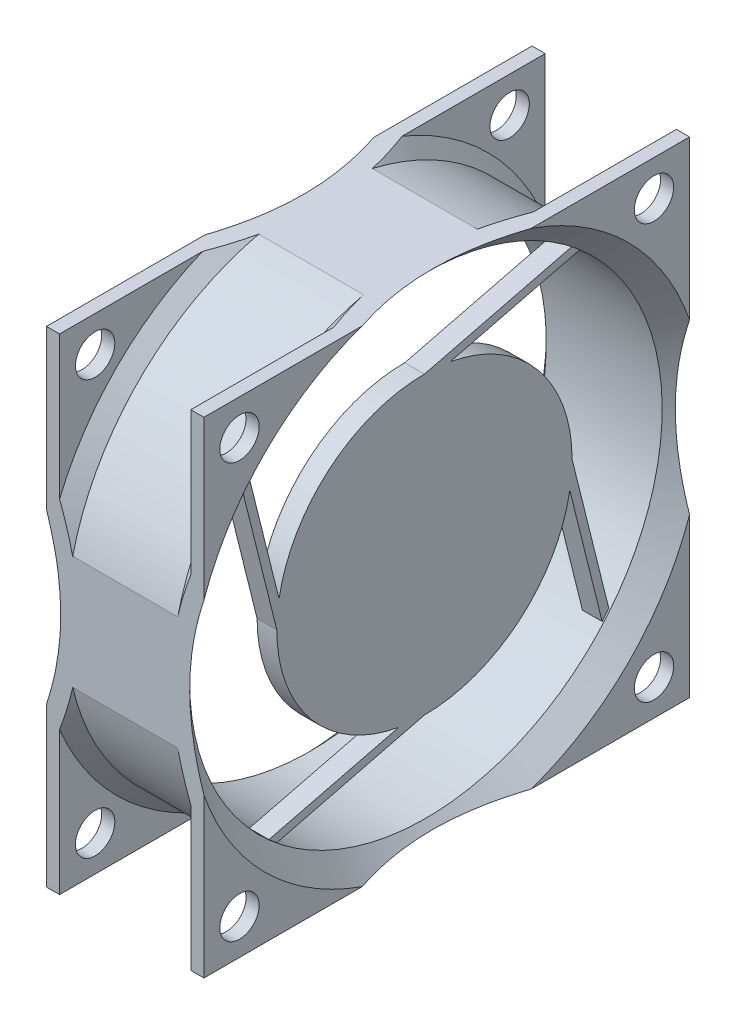
from build123d import *

# Parameters (mm, degrees)
SKETCH2_W          = 135.101639281
SKETCH2_H          = 124.912409503
SKETCH2_W_2        = 37
SKETCH2_H_2        = 37
CUT_EXTRUDE1_DEPTH = 51.927558111
SKETCH7_R          = 1.5
CUT_EXTRUDE2_DEPTH = 29.783675929
EXTRUDE8_START     = -1.7
EXTRUDE8_DEPTH     = 1.5


with BuildPart() as part:
    # Sketch1 → Revolve1 (revolve)
    with BuildSketch(Plane.XY, mode=Mode.PRIVATE) as revolve1_sk:
        Polygon((0, 19), (4, 19), (5, 20), (5, 34.997258286), (6, 34.997258286), (6, 19.585786438), (4.414213562, 18), (0, 18), (-4.414213562, 18), (-6, 19.585786438), (-6, 34.997258286), (-5, 34.997258286), (-5, 20), (-4, 19), align=None)
    revolve(revolve1_sk.sketch.rotate(Axis((0, 0, 0), (1, 0, 0)), 90), axis=Axis((0, 0, 0), (1, 0, 0)))

    # Sketch2 → Cut-Extrude1 (cut, through all)
    with BuildSketch(Plane(origin=(6, 0, 0), x_dir=(0, 0, -1), z_dir=(1, 0, 0))):
        with Locations((-3.490754647, 1.981239123)):
            Rectangle(SKETCH2_W, SKETCH2_H)
        Rectangle(SKETCH2_W_2, SKETCH2_H_2, mode=Mode.SUBTRACT)
    extrude(amount=-CUT_EXTRUDE1_DEPTH, mode=Mode.SUBTRACT)

    # Sketch7 → Cut-Extrude2 (cut, through all)
    with BuildSketch(Plane.ZY.offset(6)):
        with Locations((15.792736582, 15.791678814)):
            Circle(SKETCH7_R)
        with Locations(Location((15.792736582, -15.791678814, 0), (0, 0, 180))):
            Circle(SKETCH7_R)
        with Locations((-15.792736582, -15.791678814)):
            Circle(SKETCH7_R)
        with Locations(Location((-15.792736582, 15.791678814, 0), (0, 0, 180))):
            Circle(SKETCH7_R)
    extrude(amount=-CUT_EXTRUDE2_DEPTH, mode=Mode.SUBTRACT)


with BuildPart() as body_2:
    # Sketch8 → Extrude8 (new body)
    with BuildSketch(Plane(origin=(6, 0, 0), x_dir=(0, 0, -1), z_dir=(1, 0, 0)).offset(EXTRUDE8_START)):
        with BuildLine():
            Line((0, 11.25), (11.25, 14.051245496))
            Line((11.25, 14.051245496), (11.856665779, 13.543244685))
            Line((11.856665779, 13.543244685), (1.957575689, 11.078375216))
            ThreePointArc((1.957575689, 11.078375216), (8.619316287, 7.229791612), (11.25, 0))
            Line((11.25, 0), (14.051245496, -11.25))
            Line((14.051245496, -11.25), (13.543244685, -11.856665779))
            Line((13.543244685, -11.856665779), (11.078375216, -1.957575689))
            ThreePointArc((11.078375216, -1.957575689), (7.229791612, -8.619316287), (0, -11.25))
            Line((0, -11.25), (-11.25, -14.051245496))
            Line((-11.25, -14.051245496), (-11.856665779, -13.543244685))
            Line((-11.856665779, -13.543244685), (-1.957575689, -11.078375216))
            ThreePointArc((-1.957575689, -11.078375216), (-8.619316287, -7.229791612), (-11.25, 0))
            Line((-11.25, 0), (-14.051245496, 11.25))
            Line((-14.051245496, 11.25), (-13.543244685, 11.856665779))
            Line((-13.543244685, 11.856665779), (-11.078375216, 1.957575689))
            ThreePointArc((-11.078375216, 1.957575689), (-7.229791612, 8.619316287), (0, 11.25))
        make_face()
    extrude(amount=-EXTRUDE8_DEPTH)


solid = Compound([part.part, body_2.part])
